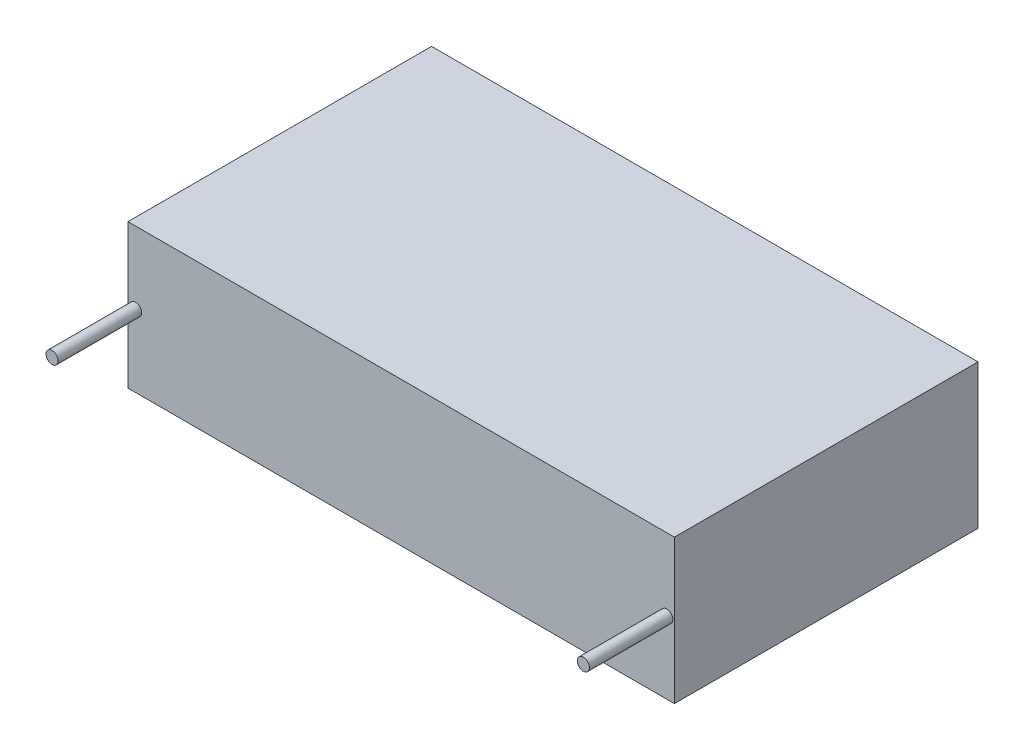
from build123d import *

# Parameters (mm, degrees)
SKETCH_1_W      = 36
SKETCH_1_H      = 9.5
EXTRUDE_1_DEPTH = 20
SKETCH_2_R      = 0.4
EXTRUDE_2_DEPTH = 5.5


with BuildPart() as part:
    # Эскиз1 → Вытянуть1 (new body)
    with BuildSketch(Plane.XY):
        with Locations((18, 4.75)):
            Rectangle(SKETCH_1_W, SKETCH_1_H)
    extrude(amount=EXTRUDE_1_DEPTH)

    # Эскиз2 → Вытянуть2 (add)
    with BuildSketch(Plane.XY.offset(20)):
        with Locations(Location((0.5, 4.75, 0), (0, 0, 180))):
            Circle(SKETCH_2_R)
        with Locations(Location((35.5, 4.75, 0), (0, 0, 180))):
            Circle(SKETCH_2_R)
    extrude(amount=EXTRUDE_2_DEPTH)


solid = part.part
